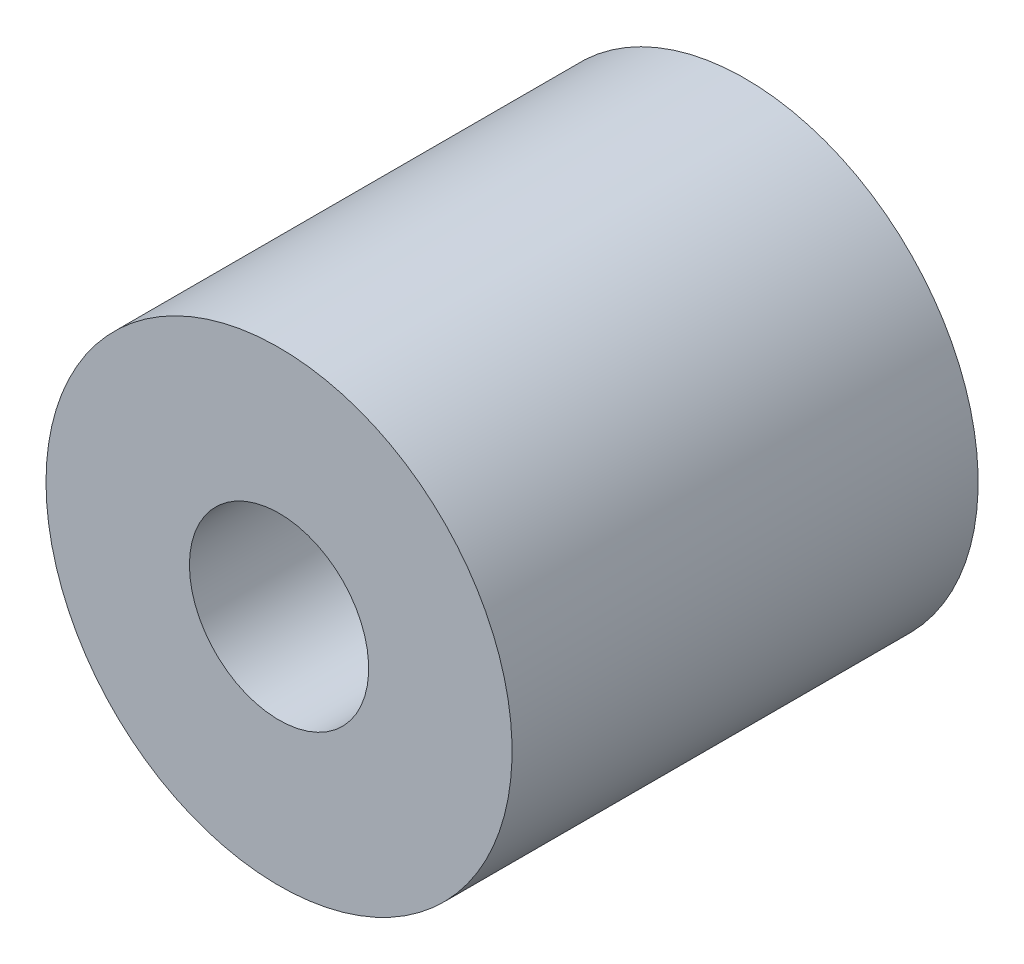
from build123d import *

# Parameters (mm, degrees)
SKETCH_1_R      = 13
SKETCH_1_R_2    = 5
EXTRUDE_1_DEPTH = 26


with BuildPart() as part:
    # 草图1 → 凸台-拉伸1 (new body)
    with BuildSketch(Plane.XY):
        with Locations(Location((0, 0, 0), (0, 0, 180))):
            Circle(SKETCH_1_R)
        with Locations(Location((0, 0, 0), (0, 0, 180))):
            Circle(SKETCH_1_R_2, mode=Mode.SUBTRACT)
    extrude(amount=EXTRUDE_1_DEPTH)


solid = part.part
